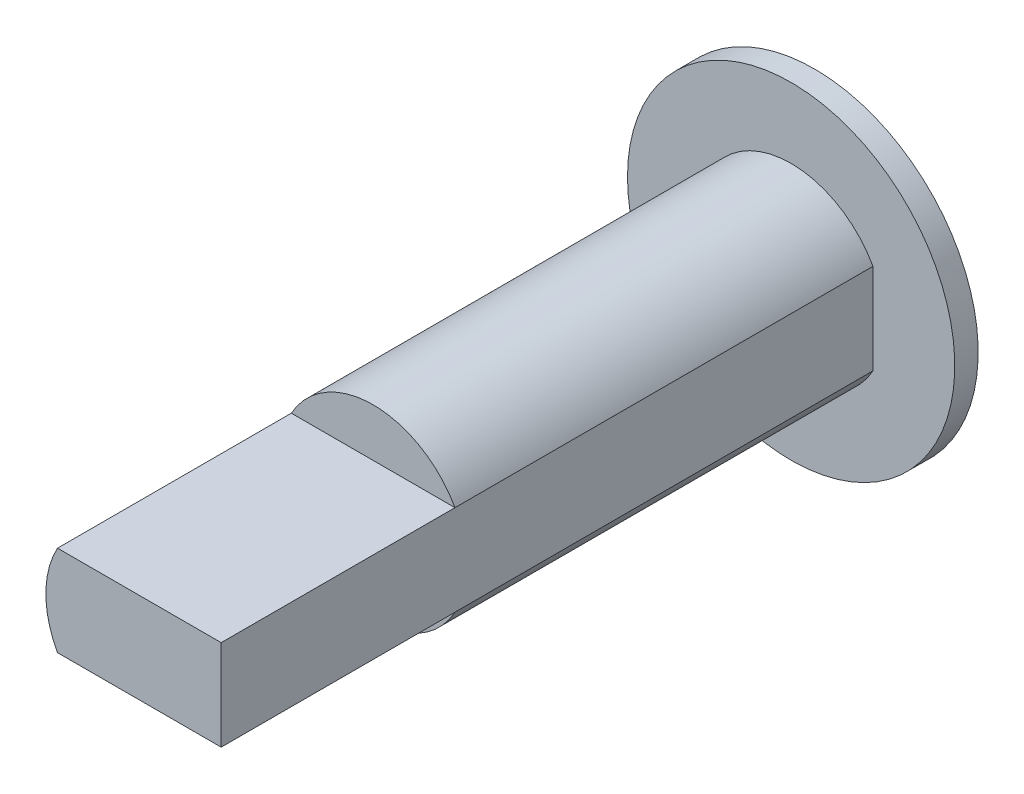
from build123d import *

# Parameters (mm, degrees)
BOSS_EXTRUDE1_DEPTH = 27.8796339
CUT_EXTRUDE1_DEPTH  = 10
SKETCH3_R           = 7
BOSS_EXTRUDE2_DEPTH = 1


with BuildPart() as part:
    # Sketch1 → Boss-Extrude1 (new body)
    with BuildSketch(Plane.XY):
        with BuildLine():
            Line((3.5, 1.936491673), (3.5, -1.936491673))
            ThreePointArc((3.5, -1.936491673), (-4, 0), (3.5, 1.936491673))
        make_face()
    extrude(amount=-BOSS_EXTRUDE1_DEPTH)

    # Sketch2 → Cut-Extrude1 (cut)
    with BuildSketch(Plane.XY):
        with BuildLine():
            Line((3.5, 1.936491673), (-3.5, 1.936491673))
            ThreePointArc((-3.5, 1.936491673), (0, 4), (3.5, 1.936491673))
        make_face()
        with BuildLine():
            Line((3.5, -1.936491673), (-3.5, -1.936491673))
            ThreePointArc((-3.5, -1.936491673), (0, -4), (3.5, -1.936491673))
        make_face()
    extrude(amount=-CUT_EXTRUDE1_DEPTH, mode=Mode.SUBTRACT)

    # Sketch3 → Boss-Extrude2 (add)
    with BuildSketch(Plane(origin=(0, 0, -27.8796339), x_dir=(-1, 0, 0), z_dir=(0, 0, -1))):
        Circle(SKETCH3_R)
    extrude(amount=BOSS_EXTRUDE2_DEPTH)


solid = part.part
